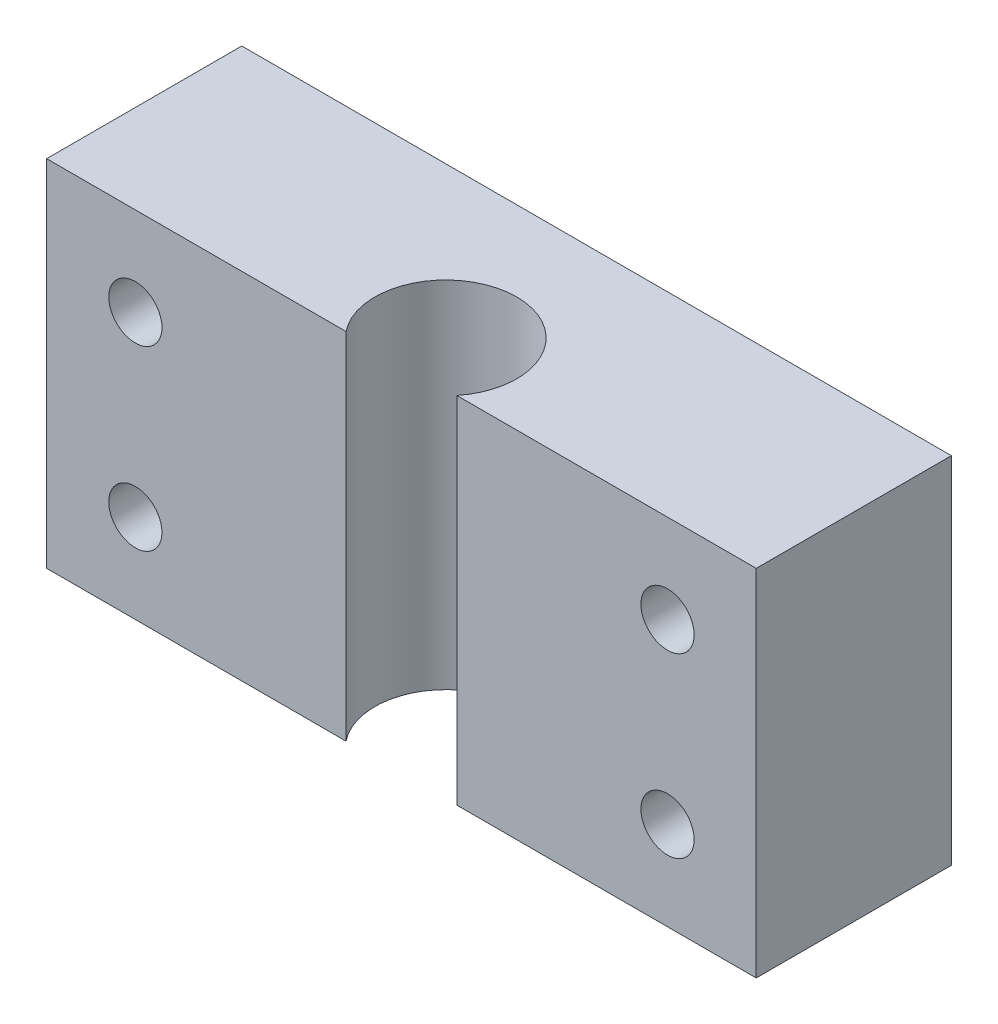
from build123d import *

# Parameters (mm, degrees)
SCHIZZO1_W                   = 80
SCHIZZO1_H                   = 40
ESTRUSIONE_ESTRUSIONE1_DEPTH = 22
SCHIZZO2_R                   = 8
TAGLIO_ESTRUSIONE1_DEPTH     = 61.695963622
SCHIZZO3_R                   = 3
TAGLIO_ESTRUSIONE2_DEPTH     = 50.839743178


with BuildPart() as part:
    # Schizzo1 → Estrusione-Estrusione1 (new body)
    with BuildSketch(Plane.XY):
        Rectangle(SCHIZZO1_W, SCHIZZO1_H)
    extrude(amount=ESTRUSIONE_ESTRUSIONE1_DEPTH)

    # Schizzo2 → Taglio-Estrusione1 (cut, through all)
    with BuildSketch(Plane.XZ.offset(20)):
        with Locations((0, 17)):
            Circle(SCHIZZO2_R)
    extrude(amount=-TAGLIO_ESTRUSIONE1_DEPTH, mode=Mode.SUBTRACT)

    # Schizzo3 → Taglio-Estrusione2 (cut, through all)
    with BuildSketch(Plane.XY.offset(22)):
        with Locations((-30, 10)):
            Circle(SCHIZZO3_R)
        with Locations(Location((-30, -10, 0), (0, 0, 180))):
            Circle(SCHIZZO3_R)
        with Locations((30, -10)):
            Circle(SCHIZZO3_R)
        with Locations(Location((30, 10, 0), (0, 0, 180))):
            Circle(SCHIZZO3_R)
    extrude(amount=-TAGLIO_ESTRUSIONE2_DEPTH, mode=Mode.SUBTRACT)


solid = part.part
